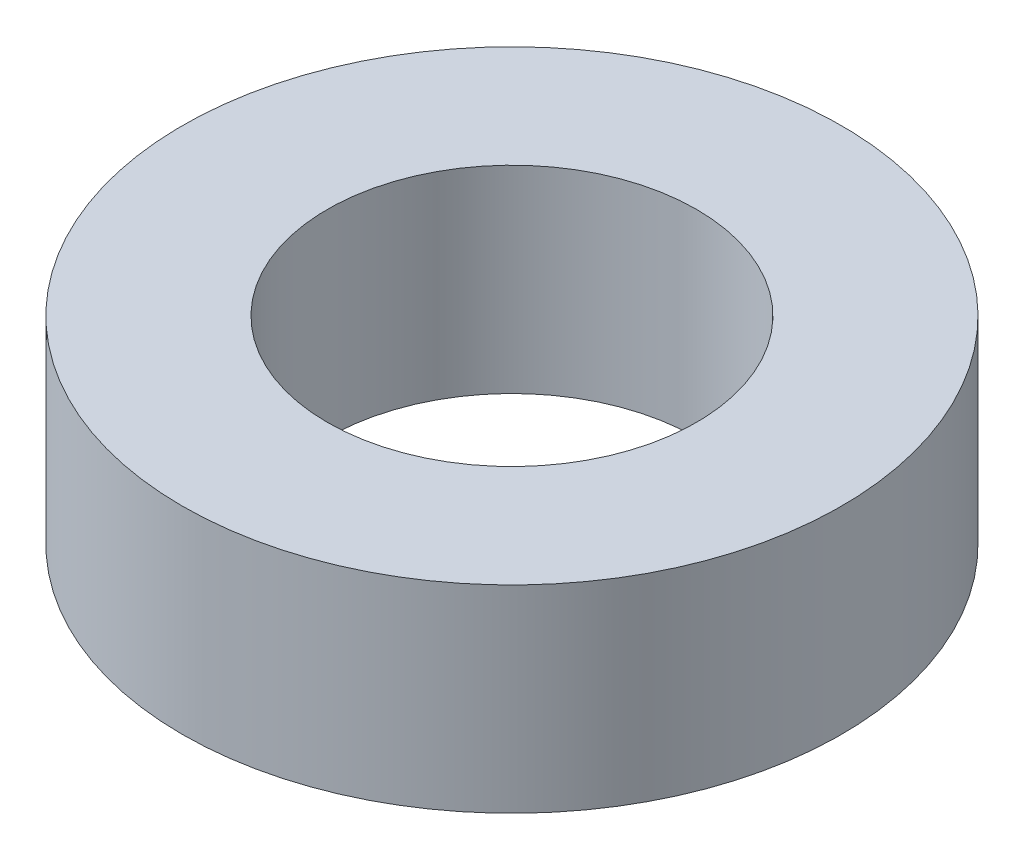
from build123d import *

# Parameters (mm, degrees)
SKETCH1_R           = 12.5
SKETCH1_R_2         = 7
BOSS_EXTRUDE1_DEPTH = 7.5


with BuildPart() as part:
    # Sketch1 → Boss-Extrude1 (new body)
    with BuildSketch(Plane(origin=(0, 0, 0), x_dir=(1, 0, 0), z_dir=(0, 1, 0))):
        with Locations(Location((0, 0, 0), (0, 0, 270))):
            Circle(SKETCH1_R)
        with Locations(Location((0, 0, 0), (0, 0, 270))):
            Circle(SKETCH1_R_2, mode=Mode.SUBTRACT)
    extrude(amount=BOSS_EXTRUDE1_DEPTH)


solid = part.part
